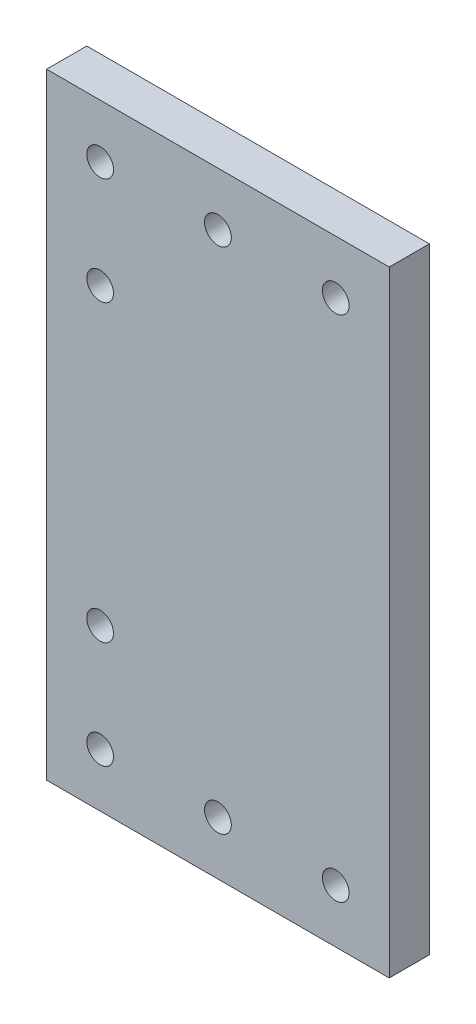
from build123d import *

# Parameters (mm, degrees)
SKETCH1_W           = 64
SKETCH1_H           = 115
BOSS_EXTRUDE1_DEPTH = 3.75
SKETCH2_R           = 2.5
CUT_EXTRUDE1_DEPTH  = 67.230657554


with BuildPart() as part:
    # Sketch1 → Boss-Extrude1 (new, symmetric)
    with BuildSketch(Plane.XY):
        Rectangle(SKETCH1_W, SKETCH1_H)
    extrude(amount=BOSS_EXTRUDE1_DEPTH, both=True)

    # Sketch2 → Cut-Extrude1 (cut, symmetric)
    with BuildSketch(Plane.XY.offset(3.75)):
        with Locations((-22, 47.5)):
            Circle(SKETCH2_R)
        with Locations((0, 47.5)):
            Circle(SKETCH2_R)
        with Locations((22, 47.5)):
            Circle(SKETCH2_R)
        with Locations((-22, 27.5)):
            Circle(SKETCH2_R)
    cut_extrude1 = extrude(amount=CUT_EXTRUDE1_DEPTH, both=True, mode=Mode.SUBTRACT)

    # Mirror1: Cut-Extrude1 across plane
    add(cut_extrude1.mirror(Plane.ZX), mode=Mode.SUBTRACT)


solid = part.part
